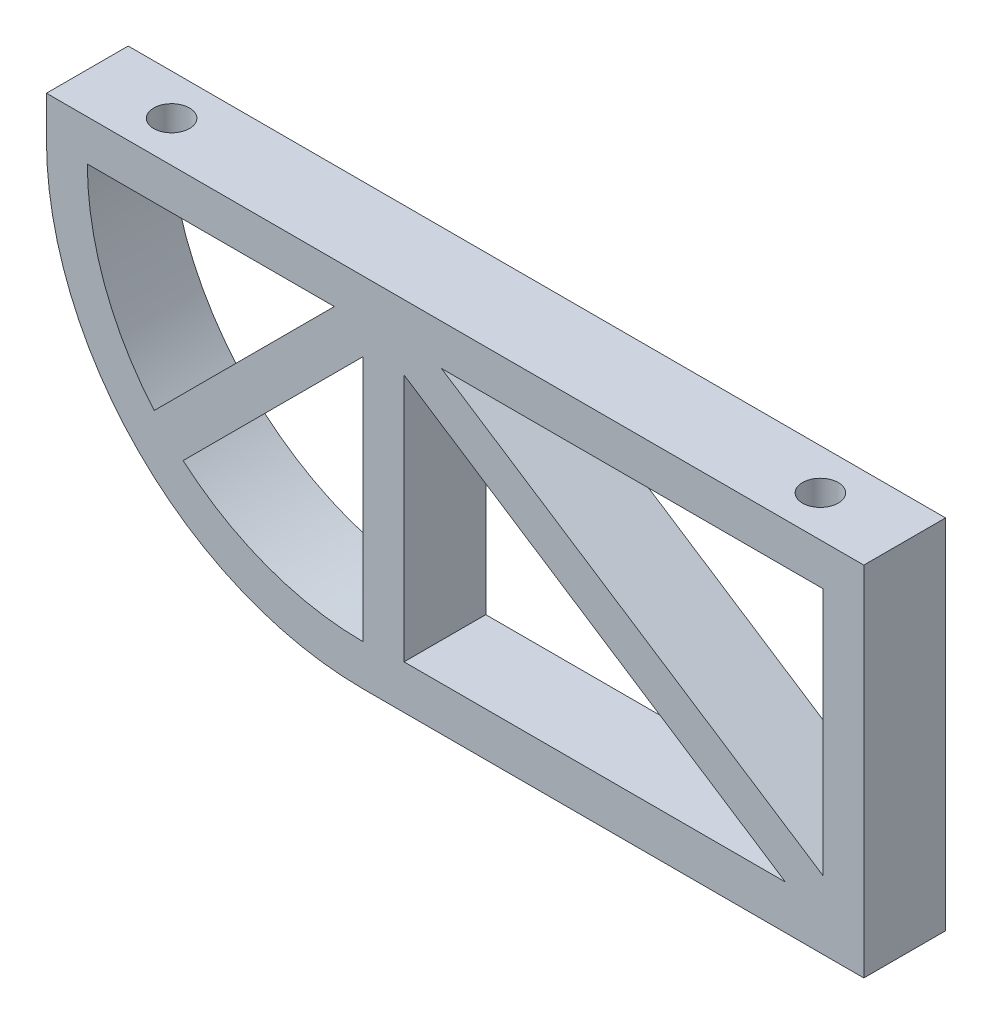
from build123d import *

# Parameters (mm, degrees)
SALIENTE_EXTRUIR1_DEPTH = 8
CROQUIS2_R              = 1.75
CORTAR_EXTRUIR1_DEPTH   = 8


with BuildPart() as part:
    # Croquis1 → Saliente-Extruir1 (new body)
    with BuildSketch(Plane.XY):
        with BuildLine():
            ThreePointArc((-26.101559178, 12.607406095), (-17.021869395, -9.312904122), (4.898440822, -18.392593905))
            Line((4.898440822, -18.392593905), (53.898440822, -18.392593905))
            Line((53.898440822, -18.392593905), (53.898440822, 16.607406095))
            Line((53.898440822, 16.607406095), (-26.101559178, 16.607406095))
            Line((-26.101559178, 16.607406095), (-26.101559178, 12.607406095))
        make_face()
        with BuildLine():
            Line((-12.72677838, -7.846240232), (4.898440822, 9.77897897))
            Line((4.898440822, 9.77897897), (4.898440822, -14.392593905))
            ThreePointArc((4.898440822, -14.392593905), (-4.502398214, -12.703149518), (-12.72677838, -7.846240232))
        make_face(mode=Mode.SUBTRACT)
        Polygon((8.898440822, -14.094653751), (8.898440822, 10.220649056), (46.233665927, -14.094653751), align=None, mode=Mode.SUBTRACT)
        with BuildLine():
            Line((2.070013697, 12.607406095), (-15.555205505, -5.017813107))
            ThreePointArc((-15.555205505, -5.017813107), (-20.41211479, 3.206567059), (-22.101559178, 12.607406095))
            Line((-22.101559178, 12.607406095), (2.070013697, 12.607406095))
        make_face(mode=Mode.SUBTRACT)
        Polygon((49.898440822, 12.607406095), (49.898440822, -11.707896712), (12.563215718, 12.607406095), align=None, mode=Mode.SUBTRACT)
    extrude(amount=SALIENTE_EXTRUIR1_DEPTH)

    # Croquis2 → Cortar-Extruir1 (cut)
    with BuildSketch(Plane(origin=(0, 16.607406095, 0), x_dir=(1, 0, 0), z_dir=(0, 1, 0))):
        with Locations(Location((-17.851559178, -4, 0), (0, 0, 270))):
            Circle(CROQUIS2_R)
        with Locations(Location((45.648440822, -4, 0), (0, 0, 270))):
            Circle(CROQUIS2_R)
    extrude(amount=-CORTAR_EXTRUIR1_DEPTH, mode=Mode.SUBTRACT)


solid = part.part
